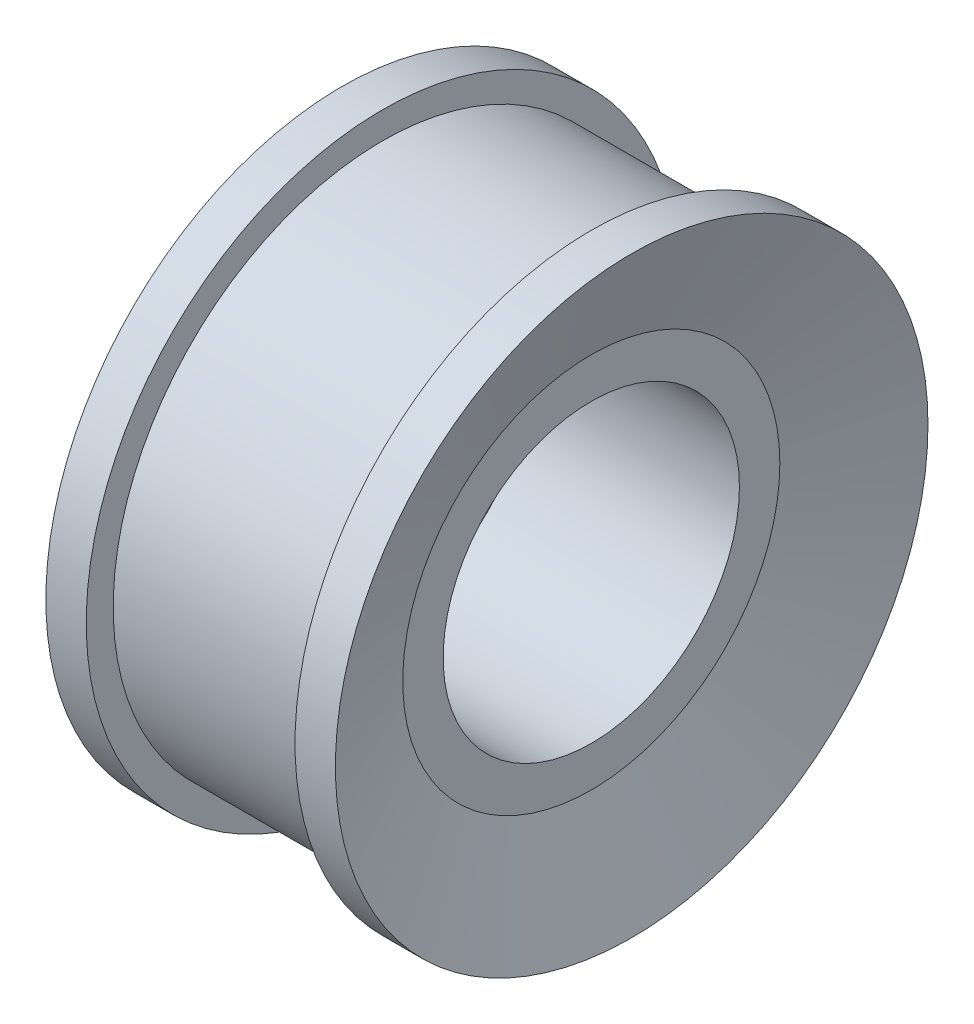
from build123d import *


with BuildPart() as part:
    # Sketch2 → Revolve1 (revolve)
    with BuildSketch(Plane.XY, mode=Mode.PRIVATE) as revolve1_sk:
        Polygon((-7.75, 11), (0, 11), (0, 20), (-7.75, 20), (-7.75, 14), align=None)
        Polygon((-7.75, 14), (-7.75, 20), (-7.75, 22), (-10.75, 22), align=None)
        Polygon((0, 20), (0, 11), (7.75, 11), (7.75, 14), (7.75, 20), align=None)
        Polygon((7.75, 22), (7.75, 20), (7.75, 14), (10.75, 22), align=None)
    revolve(revolve1_sk.sketch.rotate(Axis((11.825, 0, 0), (-1, 0, 0)), 90), axis=Axis((11.825, 0, 0), (-1, 0, 0)))


solid = part.part
